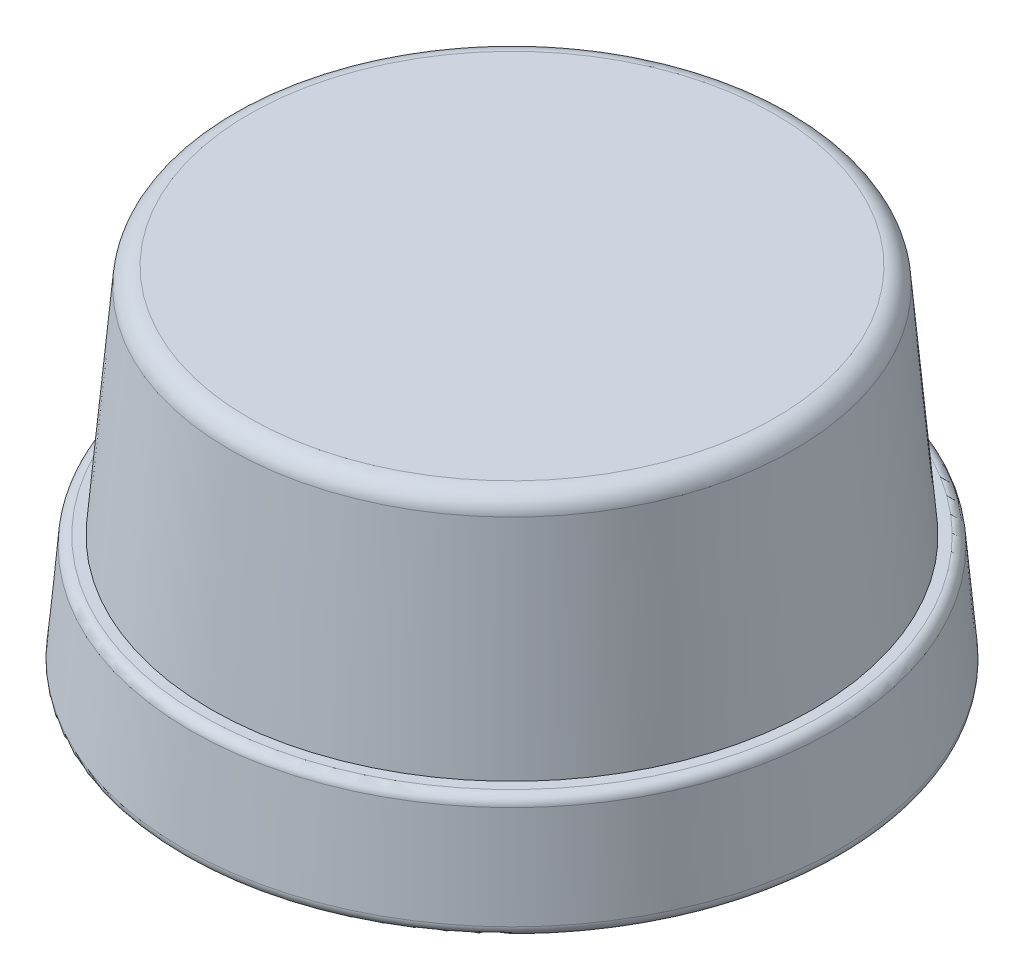
from build123d import *

# Parameters (mm, degrees)
SKETCH1_R           = 17
BOSS_EXTRUDE1_DEPTH = 6
BOSS_EXTRUDE1_TAPER = 5
SKETCH2_R           = 15.5
BOSS_EXTRUDE2_DEPTH = 12
BOSS_EXTRUDE2_TAPER = 5
SKETCH3_R           = 3.05
CUT_EXTRUDE1_DEPTH  = 17
FILLET1_R           = 1
FILLET2_R           = 0.5
SKETCH8_R           = 4.5
CUT_EXTRUDE6_DEPTH  = 8
FILLET3_R           = 0.5


with BuildPart() as part:
    # Sketch1 → Boss-Extrude1 (new body)
    with BuildSketch(Plane(origin=(0, 0, 0), x_dir=(1, 0, 0), z_dir=(0, 1, 0))):
        Circle(SKETCH1_R)
    extrude(amount=BOSS_EXTRUDE1_DEPTH, taper=BOSS_EXTRUDE1_TAPER)

    # Sketch2 → Boss-Extrude2 (add)
    with BuildSketch(Plane(origin=(0, 6, 0), x_dir=(1, 0, 0), z_dir=(0, 1, 0))):
        Circle(SKETCH2_R)
    extrude(amount=BOSS_EXTRUDE2_DEPTH, taper=BOSS_EXTRUDE2_TAPER)

    # Sketch3 → Cut-Extrude1 (cut)
    with BuildSketch(Plane.XZ):
        Circle(SKETCH3_R)
    extrude(amount=-CUT_EXTRUDE1_DEPTH, mode=Mode.SUBTRACT)

    # Fillet1
    fillet1_edges = [part.edges().sort_by_distance(p)[0] for p in [
        (-14.450136038, 18, 0),
    ]]
    fillet(fillet1_edges, radius=FILLET1_R)

    # Fillet2
    fillet2_edges = [part.edges().sort_by_distance(p)[0] for p in [
        (-16.475068019, 6, 0),
    ]]
    fillet(fillet2_edges, radius=FILLET2_R)

    # Sketch8 → Cut-Extrude6 (cut)
    with BuildSketch(Plane.XZ):
        Circle(SKETCH8_R)
    extrude(amount=-CUT_EXTRUDE6_DEPTH, mode=Mode.SUBTRACT)

    # Fillet3
    fillet3_edges = [part.edges().sort_by_distance(p)[0] for p in [
        (-17, 0, 0),
    ]]
    fillet(fillet3_edges, radius=FILLET3_R)


solid = part.part
